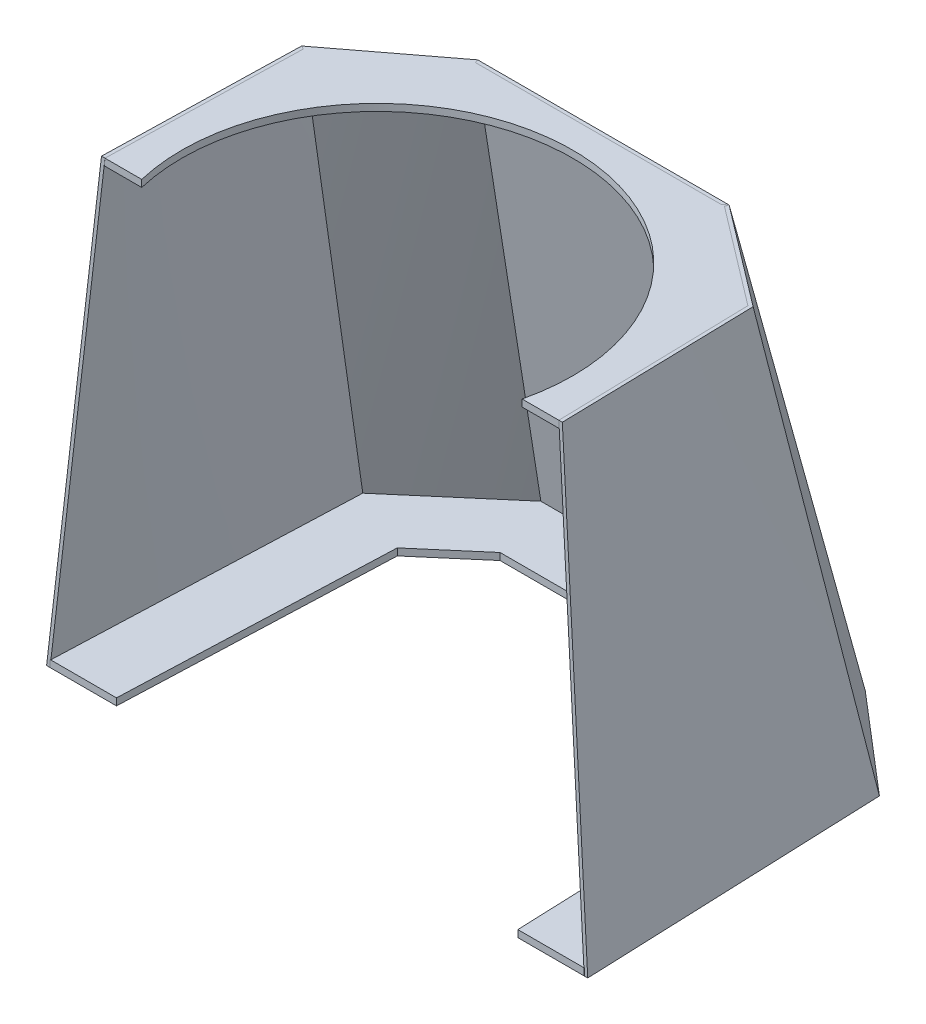
from build123d import *

# Parameters (mm, degrees)
BOSS_EXTRUDE1_DEPTH = 10
BOSS_EXTRUDE2_DEPTH = 10


with BuildPart() as part:
    # Sketch1 → Loft1 section 0
    with BuildSketch(Plane(origin=(0, 0, 0), x_dir=(1, 0, 0), z_dir=(0, 1, 0))):
        with BuildLine():
            Line((-370.547784, 89.371854891), (-387.5, -345.297700488))
            Line((-387.5, -345.297700488), (-382.496198898, -345.297700488))
            Line((-382.496198898, -345.297700488), (-365.636723379, 86.993908355))
            Line((-365.636723379, 86.993908355), (-228.152394099, 204.668656231))
            Line((-228.152394099, 204.668656231), (228.152394099, 204.668656231))
            Line((228.152394099, 204.668656231), (365.636723379, 86.993908355))
            Line((365.636723379, 86.993908355), (382.496198898, -345.297700488))
            Line((382.496198898, -345.297700488), (387.5, -345.297700488))
            Line((387.5, -345.297700488), (370.547784, 89.371854891))
            Line((370.547784, 89.371854891), (230, 209.668656231))
            Line((230, 209.668656231), (-230, 209.668656231))
            Line((-230, 209.668656231), (-370.547784, 89.371854891))
        make_face()
    # Sketch2 → Loft1 section 1
    with BuildSketch(Plane(origin=(0, 650, 0), x_dir=(1, 0, 0), z_dir=(0, 1, 0))):
        with BuildLine():
            Line((-323.301913526, -44.255912071), (-330, -324.175785674))
            Line((-330, -324.175785674), (-324.998568762, -324.175785674))
            Line((-324.998568762, -324.175785674), (-318.360896032, -46.780664139))
            Line((-318.360896032, -46.780664139), (-178.315435762, 59.668656231))
            Line((-178.315435762, 59.668656231), (178.315435762, 59.668656231))
            Line((178.315435762, 59.668656231), (318.360896032, -46.780664139))
            Line((318.360896032, -46.780664139), (324.998568762, -324.175785674))
            Line((324.998568762, -324.175785674), (330, -324.175785674))
            Line((330, -324.175785674), (323.301913526, -44.255912071))
            Line((323.301913526, -44.255912071), (180, 64.668656231))
            Line((180, 64.668656231), (-180, 64.668656231))
            Line((-180, 64.668656231), (-323.301913526, -44.255912071))
        make_face()
    loft()

    # Sketch1<51> → Boss-Extrude1 (add)
    with BuildSketch(Plane(origin=(0, 0, 0), x_dir=(1, 0, 0), z_dir=(0, 1, 0))):
        Polygon((-365.636723379, 86.993908355), (-382.496198898, -345.297700488), (-287.42397797, -345.297700488), (-283.523954195, -245.297700488), (-272.326571574, 41.812924175), (-193.047881985, 109.668656231), (193.047881985, 109.668656231), (272.326571574, 41.812924175), (283.523954195, -245.297700488), (287.42397797, -345.297700488), (382.496198898, -345.297700488), (365.636723379, 86.993908355), (228.152394099, 204.668656231), (-228.152394099, 204.668656231), align=None)
    extrude(amount=BOSS_EXTRUDE1_DEPTH)


with BuildPart() as body_2:
    # Sketch2<31> → Boss-Extrude2 (new body)
    with BuildSketch(Plane(origin=(0, 650, 0), x_dir=(1, 0, 0), z_dir=(0, 1, 0))):
        with BuildLine():
            Line((-318.360896032, -46.780664139), (-324.998568762, -324.175785674))
            Line((-324.998568762, -324.175785674), (-272.350876628, -324.175785674))
            ThreePointArc((-272.350876628, -324.175785674), (0, 20.824214326), (272.350876628, -324.175785674))
            Line((272.350876628, -324.175785674), (324.998568762, -324.175785674))
            Line((324.998568762, -324.175785674), (318.360896032, -46.780664139))
            Line((318.360896032, -46.780664139), (178.315435762, 59.668656231))
            Line((178.315435762, 59.668656231), (-178.315435762, 59.668656231))
            Line((-178.315435762, 59.668656231), (-318.360896032, -46.780664139))
        make_face()
        Polygon((-323.301913526, -44.255912071), (-330, -324.175785674), (-324.998568762, -324.175785674), (-318.360896032, -46.780664139), (-178.315435762, 59.668656231), (178.315435762, 59.668656231), (318.360896032, -46.780664139), (324.998568762, -324.175785674), (330, -324.175785674), (323.301913526, -44.255912071), (180, 64.668656231), (-180, 64.668656231), align=None)
    extrude(amount=-BOSS_EXTRUDE2_DEPTH)


solid = Compound([part.part, body_2.part])
